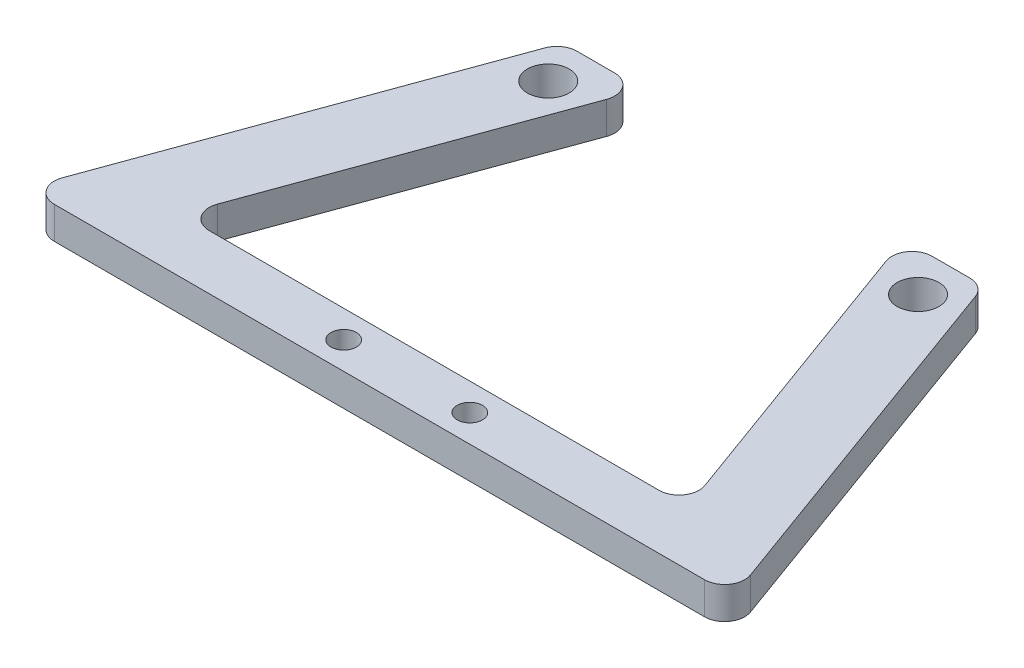
from build123d import *

# Parameters (mm, degrees)
SKETCH2_R           = 1.65
SKETCH2_R_2         = 1
BOSS_EXTRUDE1_DEPTH = 2.54


with BuildPart() as part:
    # Sketch2 → Boss-Extrude1 (new body)
    with BuildSketch(Plane(origin=(0, 0, 0), x_dir=(1, 0, 0), z_dir=(0, 1, 0))):
        with BuildLine():
            Line((-0.380182569, -1.044543022), (-10.549510914, -28.984543022))
            ThreePointArc((-10.549510914, -28.984543022), (-10.358152749, -30.438052593), (-9.057748878, -31.115))
            Line((-9.057748878, -31.115), (42.306537891, -31.115))
            ThreePointArc((42.306537891, -31.115), (43.606941761, -30.438052593), (43.798299926, -28.984543022))
            Line((43.798299926, -28.984543022), (33.628971581, -1.044543022))
            ThreePointArc((33.628971581, -1.044543022), (33.047762138, -0.28709613), (32.137209546, 0))
            Line((32.137209546, 0), (29.165973973, 0))
            ThreePointArc((29.165973973, 0), (27.865570103, -0.676947407), (27.674211938, -2.130456978))
            Line((27.674211938, -2.130456978), (35.876676455, -24.666543022))
            ThreePointArc((35.876676455, -24.666543022), (35.68531829, -26.120052593), (34.384914419, -26.797))
            Line((34.384914419, -26.797), (-1.136125407, -26.797))
            ThreePointArc((-1.136125407, -26.797), (-2.436529277, -26.120052593), (-2.627887442, -24.666543022))
            Line((-2.627887442, -24.666543022), (5.574577075, -2.130456978))
            ThreePointArc((5.574577075, -2.130456978), (5.38321891, -0.676947407), (4.082815039, 0))
            Line((4.082815039, 0), (1.111579467, 0))
            ThreePointArc((1.111579467, 0), (0.201026874, -0.28709613), (-0.380182569, -1.044543022))
        make_face()
        with Locations(Location((2.019394506, -3.175, 0), (0, 0, 270))):
            Circle(SKETCH2_R, mode=Mode.SUBTRACT)
        with Locations(Location((11.642694506, -28.956, 0), (0, 0, 270))):
            Circle(SKETCH2_R_2, mode=Mode.SUBTRACT)
        with Locations(Location((21.606094506, -28.956, 0), (0, 0, 90))):
            Circle(SKETCH2_R_2, mode=Mode.SUBTRACT)
        with Locations(Location((31.229394506, -3.175, 0), (0, 0, 90))):
            Circle(SKETCH2_R, mode=Mode.SUBTRACT)
    extrude(amount=BOSS_EXTRUDE1_DEPTH)


solid = part.part
